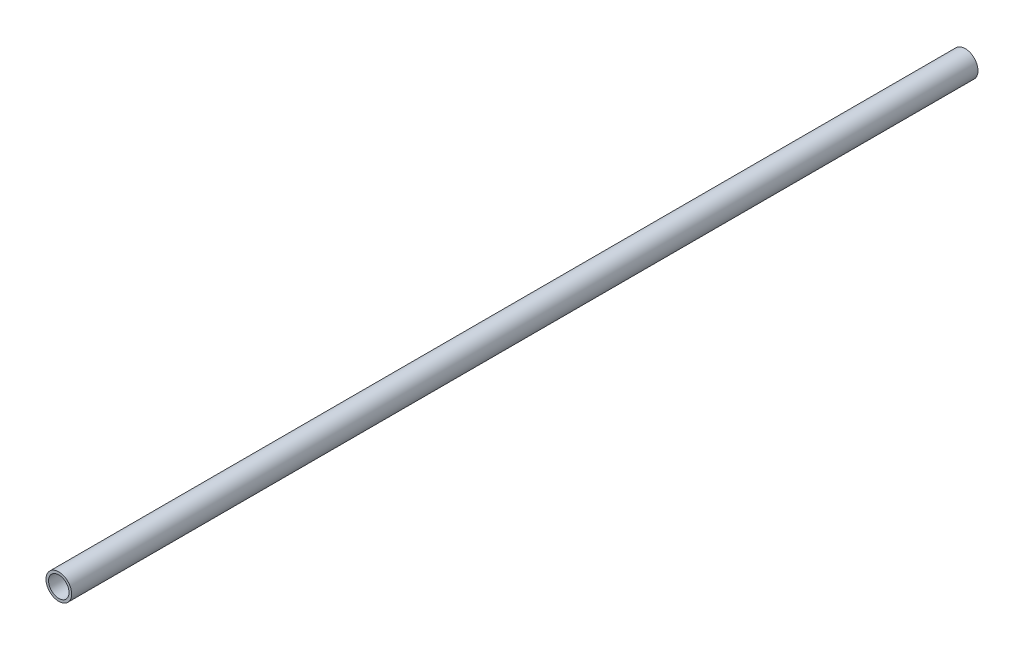
from build123d import *

# Parameters (mm, degrees)
SKETCH1_R           = 16.7005
SKETCH1_R_2         = 13.3223
BOSS_EXTRUDE1_DEPTH = 1181.1


with BuildPart() as part:
    # Sketch1 → Boss-Extrude1 (new body)
    with BuildSketch(Plane.XY):
        Circle(SKETCH1_R)
        Circle(SKETCH1_R_2, mode=Mode.SUBTRACT)
    extrude(amount=BOSS_EXTRUDE1_DEPTH)


solid = part.part
